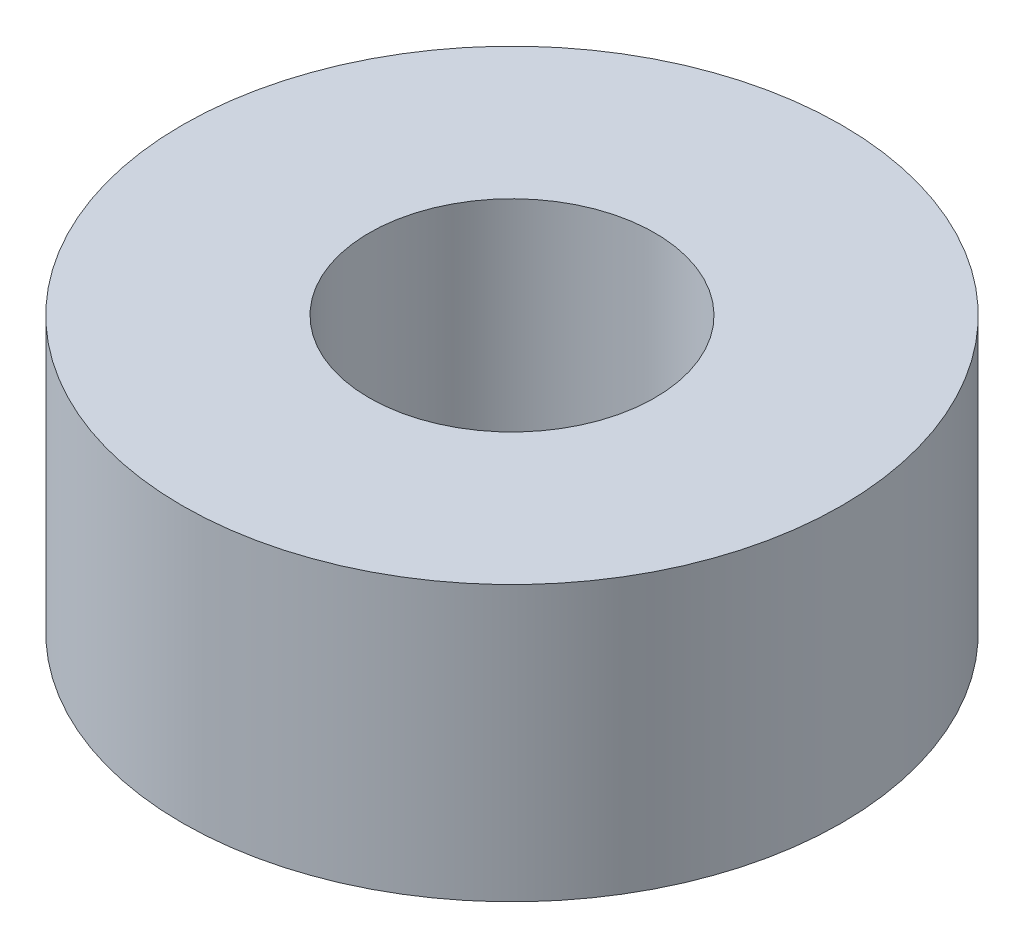
from build123d import *

# Parameters (mm, degrees)
SKETCH1_R           = 6
SKETCH1_R_2         = 2.6
BOSS_EXTRUDE1_DEPTH = 5


with BuildPart() as part:
    # Sketch1 → Boss-Extrude1 (new body)
    with BuildSketch(Plane(origin=(0, 0, 0), x_dir=(1, 0, 0), z_dir=(0, 1, 0))):
        with Locations(Location((0, 0, 0), (0, 0, 270))):
            Circle(SKETCH1_R)
        with Locations(Location((0, 0, 0), (0, 0, 270))):
            Circle(SKETCH1_R_2, mode=Mode.SUBTRACT)
    extrude(amount=BOSS_EXTRUDE1_DEPTH)


solid = part.part
